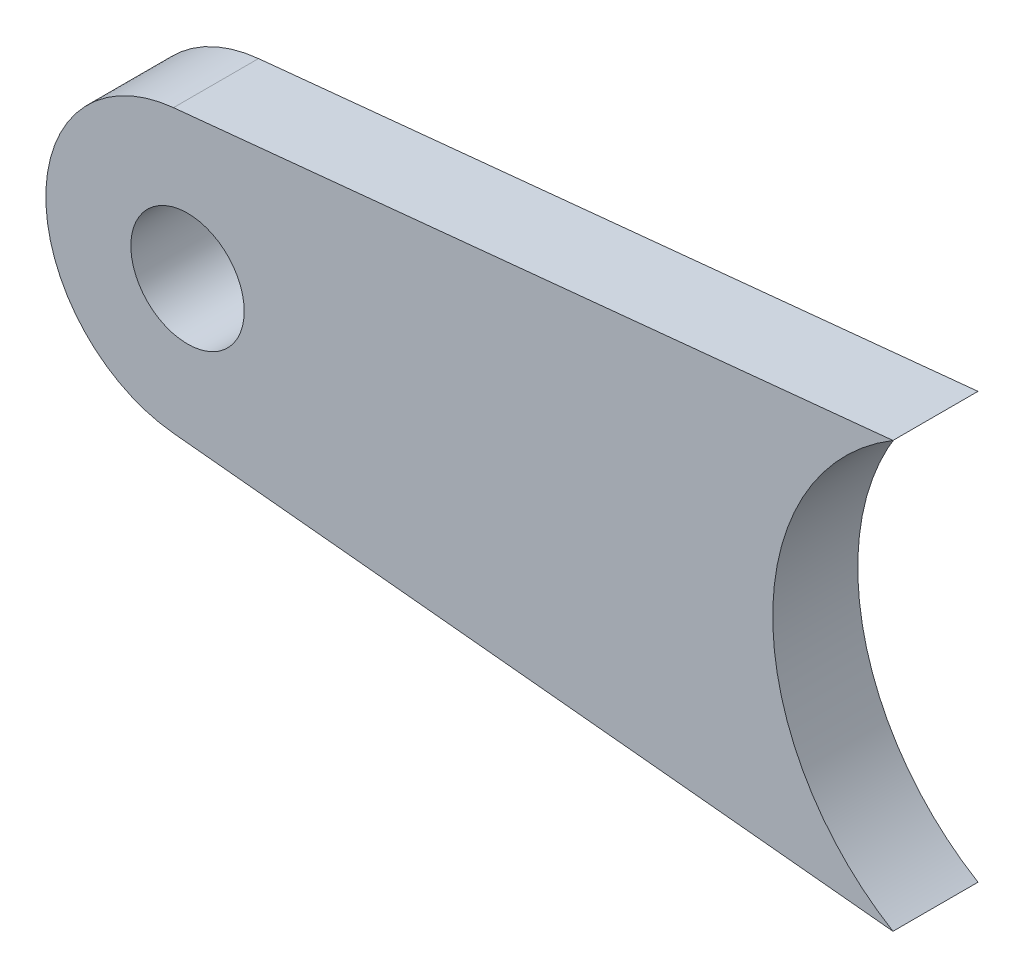
from build123d import *

# Parameters (mm, degrees)
SKETCH1_R           = 8
BOSS_EXTRUDE1_DEPTH = 6


with BuildPart() as part:
    # Sketch1 → Boss-Extrude1 (new, symmetric)
    with BuildSketch(Plane.XY):
        with BuildLine():
            Line((93.1141034, 107.126918643), (-8.437159468, 97.02876486))
            ThreePointArc((-8.437159468, 97.02876486), (-26.458140222, 77.126918643), (-8.437159468, 57.225072427))
            Line((-8.437159468, 57.225072427), (93.1141034, 47.126918643))
            ThreePointArc((93.1141034, 47.126918643), (76.141859778, 77.126918643), (93.1141034, 107.126918643))
        make_face()
        with Locations((-6.458140222, 77.126918643)):
            Circle(SKETCH1_R, mode=Mode.SUBTRACT)
    extrude(amount=BOSS_EXTRUDE1_DEPTH, both=True)


solid = part.part
